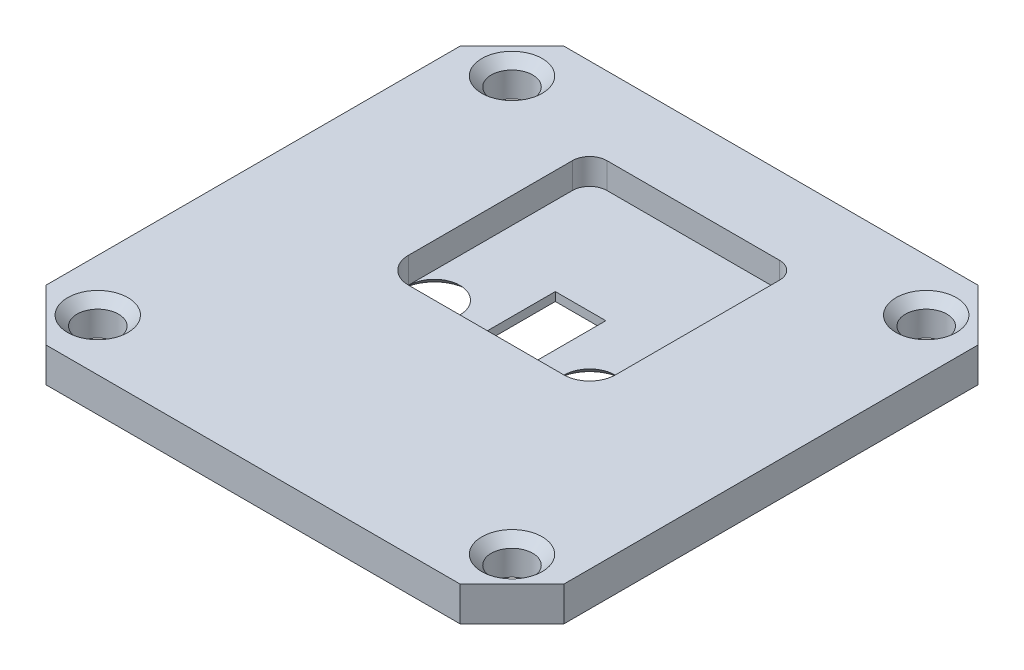
from build123d import *

# Parameters (mm, degrees)
SKETCH1_W                                            = 2.925965508
SKETCH1_H                                            = 4.901580006
BOSS_EXTRUDE1_DEPTH                                  = 2
CSK_FOR_M2_FLAT_HEAD_MACHINE_SCREW2_D                = 2.4
CSK_FOR_M2_FLAT_HEAD_MACHINE_SCREW2_DEPTH            = 42.93
CSK_FOR_M2_FLAT_HEAD_MACHINE_SCREW2_CSINK_D          = 3.5
CSK_FOR_M2_FLAT_HEAD_MACHINE_SCREW2_CSINK_ANGLE      = 90
CSK_FOR_M2_FLAT_HEAD_MACHINE_SCREW2_TIP              = 0.721032743
CSK_FOR_M2_CROSS_COUNTERSUNK_HEAD_SCREW1_D           = 2.75
CSK_FOR_M2_CROSS_COUNTERSUNK_HEAD_SCREW1_DEPTH       = 8.7
CSK_FOR_M2_CROSS_COUNTERSUNK_HEAD_SCREW1_CSINK_D     = 4
CSK_FOR_M2_CROSS_COUNTERSUNK_HEAD_SCREW1_CSINK_ANGLE = 92
CSK_FOR_M2_CROSS_COUNTERSUNK_HEAD_SCREW1_TIP         = 0.826183351
CUT_EXTRUDE1_DEPTH                                   = 1.5


with BuildPart() as part:
    # Sketch1 → Boss-Extrude1 (new body)
    with BuildSketch(Plane(origin=(0, 0, 0), x_dir=(1, 0, 0), z_dir=(0, 1, 0))):
        Polygon((-11.293051345, 29.704532022), (12.706948655, 29.704532022), (15.706948655, 26.704532022), (15.706948655, 2.704532022), (12.706948655, -0.295467978), (-11.293051345, -0.295467978), (-14.293051345, 2.704532022), (-14.293051345, 26.704532022), align=None)
        with Locations((0.743965901, 16.189415938)):
            Rectangle(SKETCH1_W, SKETCH1_H, mode=Mode.SUBTRACT)
    extrude(amount=BOSS_EXTRUDE1_DEPTH)

    # CSK for M2 Flat Head Machine Screw2
    with Locations(Plane(origin=(0, 2, 0), x_dir=(1, 0, 0), z_dir=(0, 1, 0))):
        with Locations((-11.293051345, 26.704532022), (-11.293051345, 2.704532022), (12.706948655, 26.704532022), (12.706948655, 2.704532022)):
            CounterSinkHole(CSK_FOR_M2_FLAT_HEAD_MACHINE_SCREW2_D / 2, CSK_FOR_M2_FLAT_HEAD_MACHINE_SCREW2_CSINK_D / 2, depth=CSK_FOR_M2_FLAT_HEAD_MACHINE_SCREW2_DEPTH, counter_sink_angle=CSK_FOR_M2_FLAT_HEAD_MACHINE_SCREW2_CSINK_ANGLE)
            with Locations((0, 0, -(CSK_FOR_M2_FLAT_HEAD_MACHINE_SCREW2_DEPTH + CSK_FOR_M2_FLAT_HEAD_MACHINE_SCREW2_TIP / 2))):  # 118° drill point
                Cone(0, CSK_FOR_M2_FLAT_HEAD_MACHINE_SCREW2_D / 2, CSK_FOR_M2_FLAT_HEAD_MACHINE_SCREW2_TIP, mode=Mode.SUBTRACT)

    # CSK for M2 Cross Countersunk Head Screw1
    with Locations(Plane.XZ):
        with Locations((-3.793051345, -14.704532022), (5.206948655, -14.704532022)):
            CounterSinkHole(CSK_FOR_M2_CROSS_COUNTERSUNK_HEAD_SCREW1_D / 2, CSK_FOR_M2_CROSS_COUNTERSUNK_HEAD_SCREW1_CSINK_D / 2, depth=CSK_FOR_M2_CROSS_COUNTERSUNK_HEAD_SCREW1_DEPTH, counter_sink_angle=CSK_FOR_M2_CROSS_COUNTERSUNK_HEAD_SCREW1_CSINK_ANGLE)
            with Locations((0, 0, -(CSK_FOR_M2_CROSS_COUNTERSUNK_HEAD_SCREW1_DEPTH + CSK_FOR_M2_CROSS_COUNTERSUNK_HEAD_SCREW1_TIP / 2))):  # 118° drill point
                Cone(0, CSK_FOR_M2_CROSS_COUNTERSUNK_HEAD_SCREW1_D / 2, CSK_FOR_M2_CROSS_COUNTERSUNK_HEAD_SCREW1_TIP, mode=Mode.SUBTRACT)

    # Sketch11 → Cut-Extrude1 (cut)
    with BuildSketch(Plane(origin=(0, 2, 0), x_dir=(1, 0, 0), z_dir=(0, 1, 0))):
        with BuildLine():
            Line((-5.293051345, 24.204532022), (-5.293051345, 14.704532022))
            ThreePointArc((-5.293051345, 14.704532022), (-4.853711517, 13.64387185), (-3.793051345, 13.204532022))
            Line((-3.793051345, 13.204532022), (5.206948655, 13.204532022))
            ThreePointArc((5.206948655, 13.204532022), (6.267608827, 13.64387185), (6.706948655, 14.704532022))
            Line((6.706948655, 14.704532022), (6.706948655, 24.204532022))
            ThreePointArc((6.706948655, 24.204532022), (6.414055436, 24.911638803), (5.706948655, 25.204532022))
            Line((5.706948655, 25.204532022), (-4.293051345, 25.204532022))
            ThreePointArc((-4.293051345, 25.204532022), (-5.000158126, 24.911638803), (-5.293051345, 24.204532022))
        make_face()
    extrude(amount=-CUT_EXTRUDE1_DEPTH, mode=Mode.SUBTRACT)


solid = part.part
